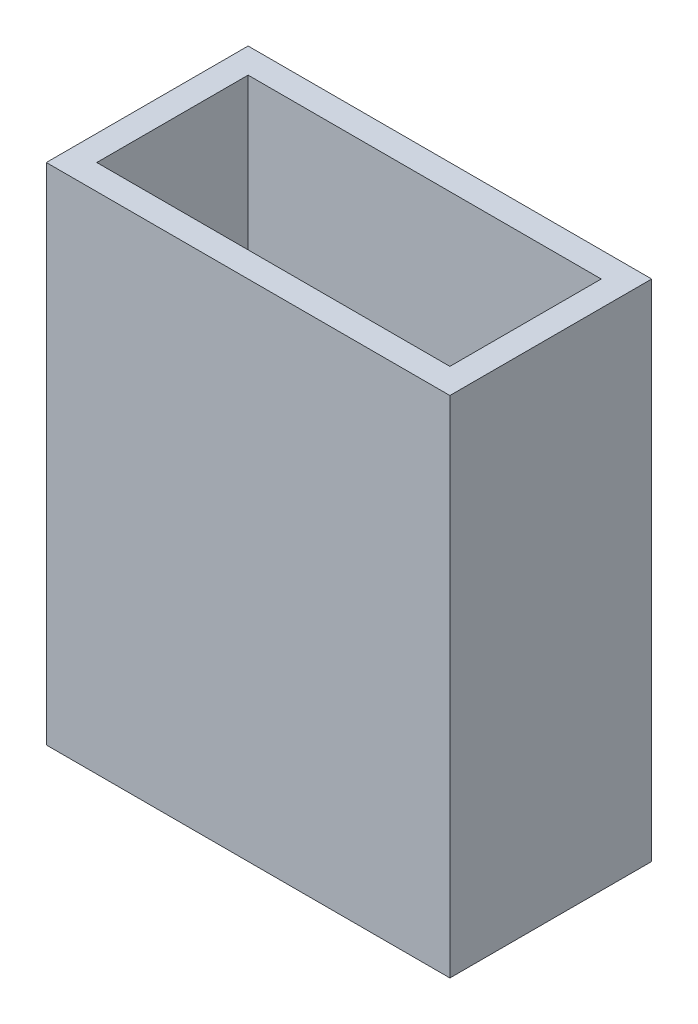
from build123d import *

# Parameters (mm, degrees)
SKETCH1_W           = 50.8
SKETCH1_H           = 25.4
SKETCH1_W_2         = 44.45
SKETCH1_H_2         = 19.05
EXTRUDE_THIN1_DEPTH = 63.5


with BuildPart() as part:
    # Sketch1 → Extrude-Thin1 (new body)
    with BuildSketch(Plane(origin=(0, 0, 0), x_dir=(1, 0, 0), z_dir=(0, 1, 0))):
        Rectangle(SKETCH1_W, SKETCH1_H)
        Rectangle(SKETCH1_W_2, SKETCH1_H_2, mode=Mode.SUBTRACT)
    extrude(amount=EXTRUDE_THIN1_DEPTH)


solid = part.part
